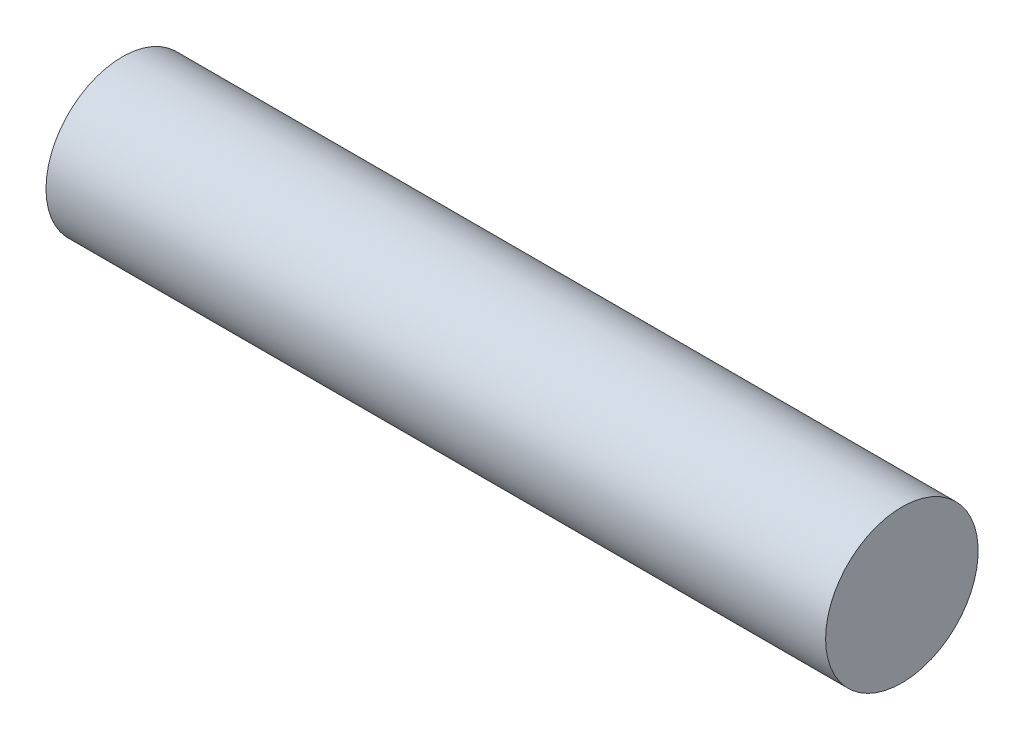
from build123d import *

# Parameters (mm, degrees)
SKETCH_1_W = 92
SKETCH_1_H = 9


with BuildPart() as part:
    # 草图1 → 旋转1 (revolve)
    with BuildSketch(Plane.XY, mode=Mode.PRIVATE) as revolve_1_sk:
        with Locations((46, 4.5)):
            Rectangle(SKETCH_1_W, SKETCH_1_H)
    revolve(revolve_1_sk.sketch.rotate(Axis((0, 0, 0), (1, 0, 0)), 90), axis=Axis((0, 0, 0), (1, 0, 0)))


solid = part.part
